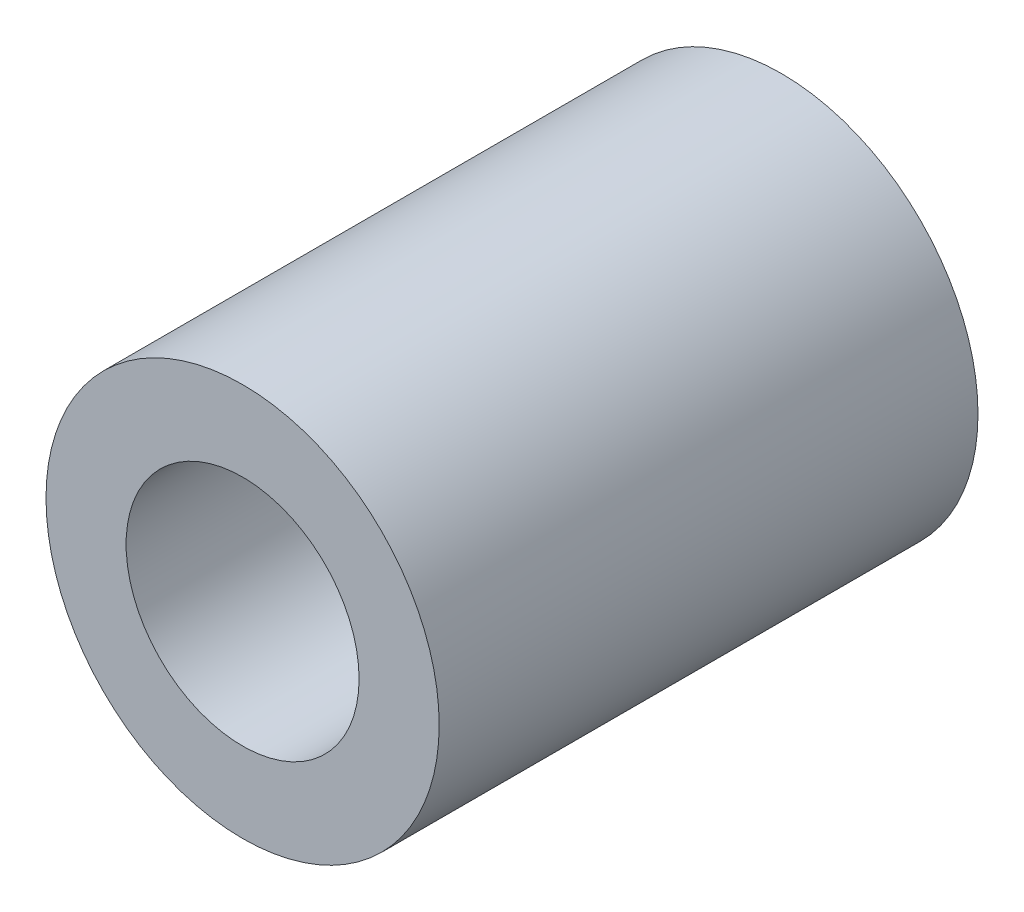
from build123d import *

# Parameters (mm, degrees)
BOSS_EXTRUDE1_DEPTH      = 18.5
BOSS_EXTRUDE1_DEPTH_BACK = 18.5
SKETCH1_R                = 13.5
SKETCH1_R_2              = 8


with BuildPart() as part:
    # Sketch1 → Boss-Extrude1 (new, two sides: drawn at the far end of the back side and taken through both)
    with BuildSketch(Plane.XY.offset(-BOSS_EXTRUDE1_DEPTH_BACK)):
        Circle(SKETCH1_R)
        Circle(SKETCH1_R_2, mode=Mode.SUBTRACT)
    extrude(amount=BOSS_EXTRUDE1_DEPTH + BOSS_EXTRUDE1_DEPTH_BACK)


solid = part.part
